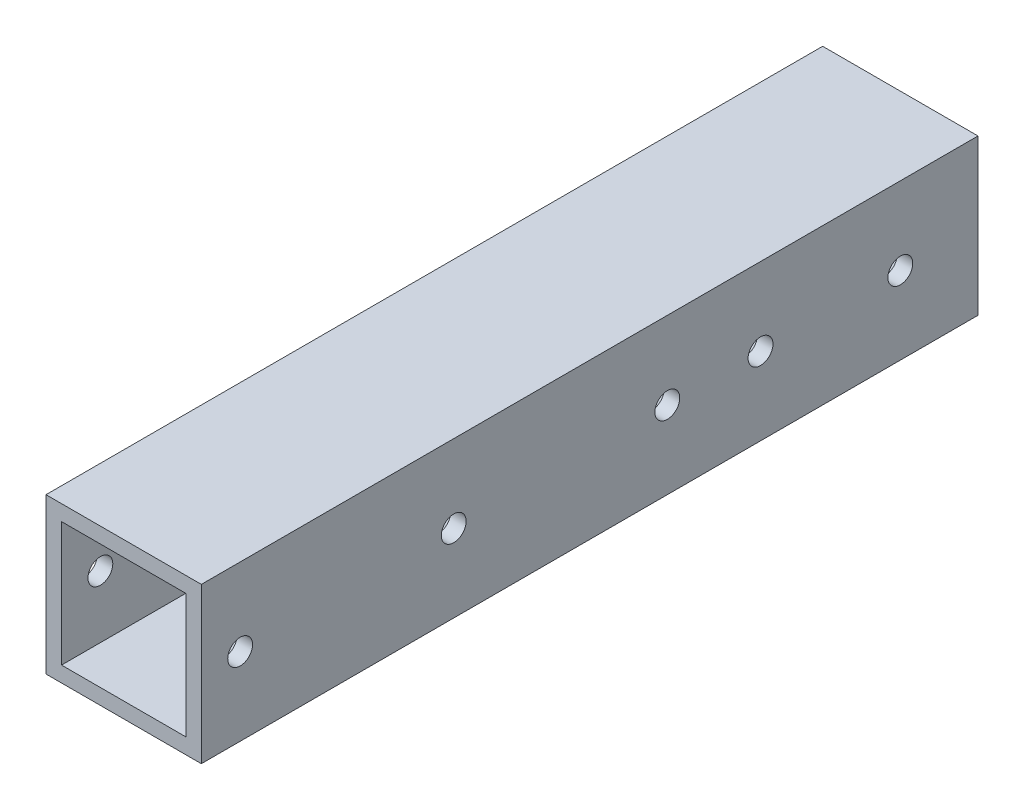
from build123d import *

# Parameters (mm, degrees)
SKETCH_1_W          = 20
SKETCH_1_H          = 20
SKETCH_1_W_2        = 16
SKETCH_1_H_2        = 16
EXTRUDE_1_DEPTH     = 100
SKETCH_2_R          = 1.6
CUT_EXTRUDE_1_DEPTH = 104.923048454
SKETCH_3_R          = 1.6
CUT_EXTRUDE_2_DEPTH = 104.923048454


with BuildPart() as part:
    # 草图1 → 拉伸-薄壁1 (new body)
    with BuildSketch(Plane.XY):
        with Locations((10, 10)):
            Rectangle(SKETCH_1_W, SKETCH_1_H)
        with Locations((10, 10)):
            Rectangle(SKETCH_1_W_2, SKETCH_1_H_2, mode=Mode.SUBTRACT)
    extrude(amount=EXTRUDE_1_DEPTH)

    # 草图2 → 切除-拉伸1 (cut, through all)
    with BuildSketch(Plane.ZY):
        with Locations((10, 10)):
            Circle(SKETCH_2_R)
        with Locations((28, 10)):
            Circle(SKETCH_2_R)
    extrude(amount=-CUT_EXTRUDE_1_DEPTH, mode=Mode.SUBTRACT)

    # 草图3 → 切除-拉伸2 (cut, through all)
    with BuildSketch(Plane.ZY):
        with Locations((67.5, 10)):
            Circle(SKETCH_3_R)
        with Locations((40, 10)):
            Circle(SKETCH_3_R)
        with Locations((95, 10)):
            Circle(SKETCH_3_R)
    extrude(amount=-CUT_EXTRUDE_2_DEPTH, mode=Mode.SUBTRACT)


solid = part.part
